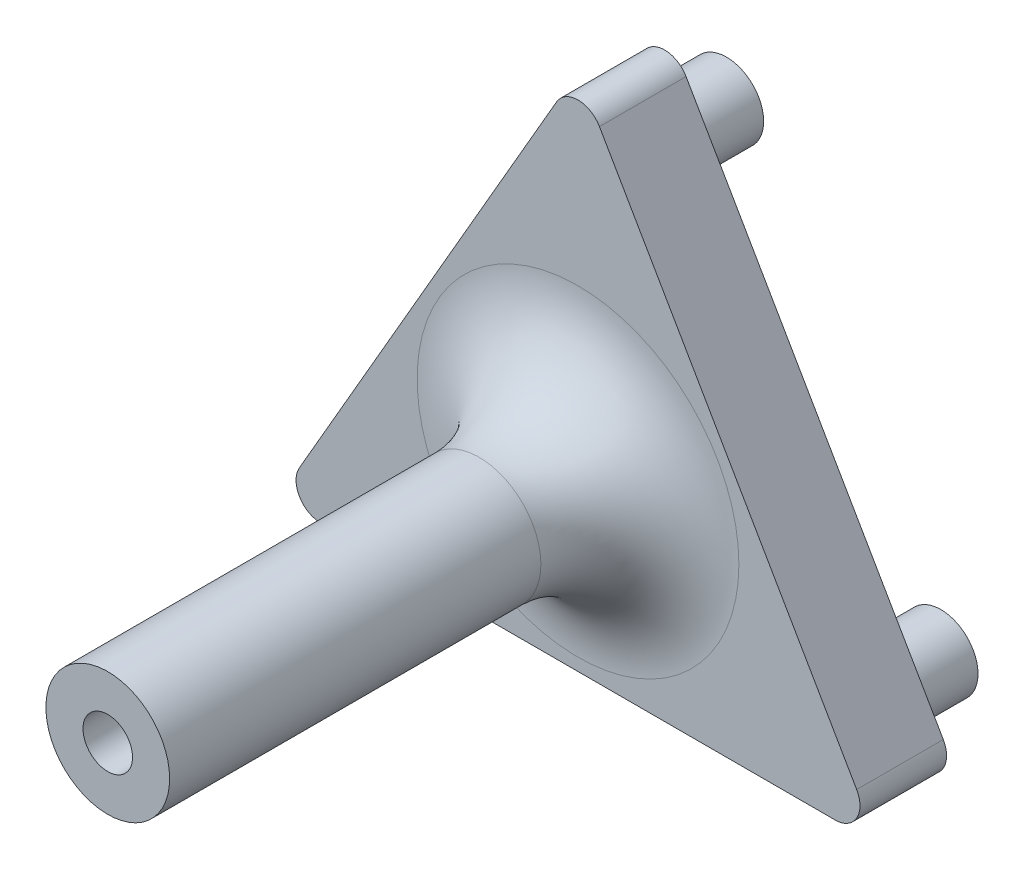
from build123d import *

# Parameters (mm, degrees)
SKETCH_1_R             = 2.5
SKETCH_1_R_2           = 1
EXTRUDE_2_DEPTH        = 24
EXTRUDE_3_DEPTH        = 2
EXTRUDE_3_DEPTH_BACK   = 1
SKETCH_3_R             = 1.5
EXTRUDE_3_2_DEPTH      = 2
EXTRUDE_3_2_DEPTH_BACK = 1
EXTRUDE_3_3_DEPTH      = 2
EXTRUDE_3_3_DEPTH_BACK = 1
SKETCH_4_R             = 2.23
CUT_EXTRUDE_1_DEPTH    = 2
EXTRUDE_6_DEPTH        = 3
EXTRUDE_6_DEPTH_BACK   = 0.5
SKETCH_10_R            = 2.35
SKETCH_10_R_2          = 2.23
CUT_EXTRUDE_2_DEPTH    = 1
SKETCH_11_R            = 3.7
CUT_EXTRUDE_3_DEPTH    = 2
SKETCH_12_R            = 1
CUT_EXTRUDE_4_DEPTH    = 27.532998323
FILLET_5_R             = 1
FILLET_6_R             = 4
SKETCH_14_R            = 2.75
SKETCH_14_R_2          = 2.23
CUT_EXTRUDE_5_DEPTH    = 2


with BuildPart() as part:
    # ｽｹｯﾁ1 → ﾎﾞｽ - 押し出し2 (new body)
    with BuildSketch(Plane.XY):
        Circle(SKETCH_1_R)
        Circle(SKETCH_1_R_2, mode=Mode.SUBTRACT)
    extrude(amount=EXTRUDE_2_DEPTH)

    # ｽｹｯﾁ4 → ｶｯﾄ - 押し出し1 (cut)
    with BuildSketch(Plane(origin=(0, 0, 0), x_dir=(-1, 0, 0), z_dir=(0, 0, -1))):
        Circle(SKETCH_4_R)
    extrude(amount=-CUT_EXTRUDE_1_DEPTH, mode=Mode.SUBTRACT)



with BuildPart() as body_2:
    # ｽｹｯﾁ3 → ﾎﾞｽ - 押し出し3 (new, two sides: drawn at the far end of the back side and taken through both)
    with BuildSketch(Plane.XY.offset(-EXTRUDE_3_DEPTH_BACK)):
        with Locations((0, 10)):
            Circle(SKETCH_3_R)
    extrude(amount=EXTRUDE_3_DEPTH + EXTRUDE_3_DEPTH_BACK)


with BuildPart() as body_3:
    # ｽｹｯﾁ3 → Extrude 3 2 (new, two sides: drawn at the far end of the back side and taken through both)
    with BuildSketch(Plane.XY.offset(-EXTRUDE_3_2_DEPTH_BACK)):
        with Locations((8.660254038, -5)):
            Circle(SKETCH_3_R)
    extrude(amount=EXTRUDE_3_2_DEPTH + EXTRUDE_3_2_DEPTH_BACK)


with BuildPart() as body_4:
    # ｽｹｯﾁ3 → Extrude 3 3 (new, two sides: drawn at the far end of the back side and taken through both)
    with BuildSketch(Plane.XY.offset(-EXTRUDE_3_3_DEPTH_BACK)):
        with Locations((-8.660254038, -5)):
            Circle(SKETCH_3_R)
    extrude(amount=EXTRUDE_3_3_DEPTH + EXTRUDE_3_3_DEPTH_BACK)


with BuildPart() as part_1:
    add(part.part)

    add(body_2.part)  # ﾎﾞｽ - 押し出し6 merges body 2

    add(body_3.part)  # ﾎﾞｽ - 押し出し6 merges body 3

    add(body_4.part)  # ﾎﾞｽ - 押し出し6 merges body 4
    # ｽｹｯﾁ5 → ﾎﾞｽ - 押し出し6 (add, two sides: drawn at the far end of the back side and taken through both)
    with BuildSketch(Plane.XY.offset(2).offset(-EXTRUDE_6_DEPTH_BACK)):
        Polygon((0, 14), (-12.124355653, -7), (12.124355653, -7), align=None)
    extrude(amount=EXTRUDE_6_DEPTH + EXTRUDE_6_DEPTH_BACK)

    # ｽｹｯﾁ10 → ｶｯﾄ - 押し出し2 (cut)
    with BuildSketch(Plane(origin=(0, 0, 0), x_dir=(-1, 0, 0), z_dir=(0, 0, -1))):
        Circle(SKETCH_10_R)
        Circle(SKETCH_10_R_2, mode=Mode.SUBTRACT)
    extrude(amount=-CUT_EXTRUDE_2_DEPTH, mode=Mode.SUBTRACT)

    # ｽｹｯﾁ11 → ｶｯﾄ - 押し出し3 (cut)
    with BuildSketch(Plane(origin=(0, 0, 1.5), x_dir=(-1, 0, 0), z_dir=(0, 0, -1))):
        Circle(SKETCH_11_R)
    extrude(amount=-CUT_EXTRUDE_3_DEPTH, mode=Mode.SUBTRACT)


with BuildPart() as cut_extrude_3_piece_1:
    # of the separate pieces the step leaves, piece 1, a body of its own (cut_extrude_3_pieces)
    add(part_1.part.solids().sort_by_distance((0, 14, 1.5))[0])

    # ｽｹｯﾁ12 → ｶｯﾄ - 押し出し4 (cut, through all)
    with BuildSketch(Plane.XY.offset(5)):
        with Locations(Location((0, 0, 0), (0, 0, 180))):
            Circle(SKETCH_12_R)
    extrude(amount=-CUT_EXTRUDE_4_DEPTH, mode=Mode.SUBTRACT)

    # ﾌｨﾚｯﾄ5
    fillet_5_edges = [cut_extrude_3_piece_1.edges().sort_by_distance(p)[0] for p in [
        (0, 14, 3.25),
        (12.124355653, -7, 3.25),
        (-12.124355653, -7, 3.25),
    ]]
    fillet(fillet_5_edges, radius=FILLET_5_R)

    # ﾌｨﾚｯﾄ6
    fillet_6_edges = [cut_extrude_3_piece_1.edges().sort_by_distance(p)[0] for p in [
        (-2.5, 0, 5),
    ]]
    fillet(fillet_6_edges, radius=FILLET_6_R)


with BuildPart() as cut_extrude_3_piece_2:
    # of the separate pieces the step leaves, piece 2, a body of its own (cut_extrude_3_pieces)
    add(part_1.part.solids().sort_by_distance((2.5, 0, 0))[0])

    # ｽｹｯﾁ14 → ｶｯﾄ - 押し出し5 (cut)
    with BuildSketch(Plane(origin=(0, 0, 0), x_dir=(-1, 0, 0), z_dir=(0, 0, -1))):
        Circle(SKETCH_14_R)
        Circle(SKETCH_14_R_2, mode=Mode.SUBTRACT)
    extrude(amount=-CUT_EXTRUDE_5_DEPTH, mode=Mode.SUBTRACT)


solid = cut_extrude_3_piece_1.part
